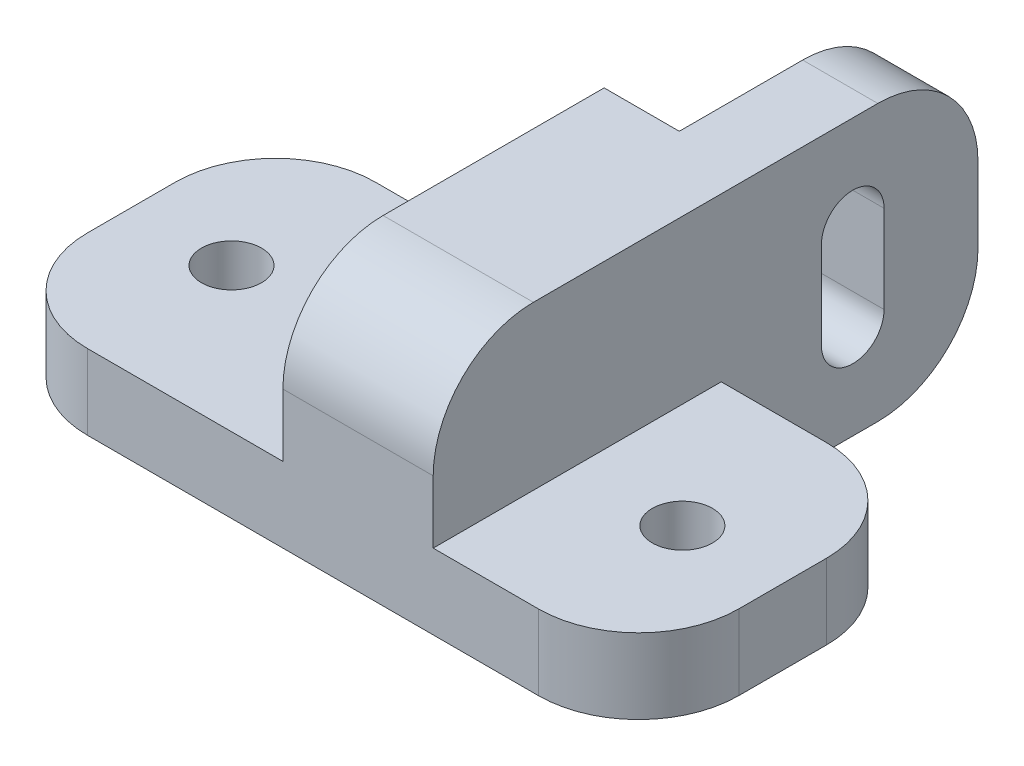
from build123d import *

# Parameters (mm, degrees)
SKETCH1_W           = 26
SKETCH1_H           = 11.5
BOSS_EXTRUDE1_DEPTH = 3
FILLET1_R           = 4
BOSS_EXTRUDE2_DEPTH = 3
FILLET2_R           = 4
BOSS_EXTRUDE3_DEPTH = 3
CUT_EXTRUDE2_DEPTH  = 4
FILLET3_R           = 4
SKETCH5_R           = 1.2
CUT_EXTRUDE3_DEPTH  = 4


with BuildPart() as part:
    # Sketch1 → Boss-Extrude1 (new body)
    with BuildSketch(Plane(origin=(0, 0, 0), x_dir=(1, 0, 0), z_dir=(0, 1, 0))):
        Rectangle(SKETCH1_W, SKETCH1_H)
    extrude(amount=BOSS_EXTRUDE1_DEPTH)

    # Fillet1
    fillet1_edges = [part.edges().sort_by_distance(p)[0] for p in [
        (13, 1.5, 5.75),
        (-13, 1.5, 5.75),
        (-13, 1.5, -5.75),
        (13, 1.5, -5.75),
    ]]
    fillet(fillet1_edges, radius=FILLET1_R)

    # Sketch2 → Boss-Extrude2 (add)
    with BuildSketch(Plane(origin=(1.8, 0, 0), x_dir=(0, 0, -1), z_dir=(1, 0, 0))):
        Polygon((0, 3), (5.75, 3), (5.75, -1.5), (16, -1.5), (16, 3), (16, 9.5), (0, 9.5), (-5.75, 9.5), (-5.75, 3), align=None)
    extrude(amount=BOSS_EXTRUDE2_DEPTH)

    # Fillet2
    fillet2_edges = [part.edges().sort_by_distance(p)[0] for p in [
        (3.3, 9.5, 5.75),
    ]]
    fillet(fillet2_edges, radius=FILLET2_R)

    # Sketch4 → Boss-Extrude3 (add)
    with BuildSketch(Plane.ZY.offset(-1.8)):
        with BuildLine():
            Line((-7.075, 9.5), (-7.075, -1.5))
            Line((-7.075, -1.5), (-5.75, -1.5))
            Line((-5.75, -1.5), (-5.75, 0))
            Line((-5.75, 0), (-5.75, 3))
            Line((-5.75, 3), (5.75, 3))
            Line((5.75, 3), (5.75, 5.5))
            ThreePointArc((5.75, 5.5), (4.578427125, 8.328427125), (1.75, 9.5))
            Line((1.75, 9.5), (-7.075, 9.5))
        make_face()
    extrude(amount=BOSS_EXTRUDE3_DEPTH)

    # Sketch3 → Cut-Extrude2 (cut)
    with BuildSketch(Plane(origin=(4.8, 0, 0), x_dir=(0, 0, -1), z_dir=(1, 0, 0))):
        with BuildLine():
            Line((9.75, 2.25), (9.75, 5.75))
            ThreePointArc((9.75, 5.75), (11, 7), (12.25, 5.75))
            Line((12.25, 5.75), (12.25, 2.25))
            ThreePointArc((12.25, 2.25), (11, 1), (9.75, 2.25))
        make_face()
    extrude(amount=-CUT_EXTRUDE2_DEPTH, mode=Mode.SUBTRACT)

    # Fillet3
    fillet3_edges = [part.edges().sort_by_distance(p)[0] for p in [
        (3.3, -1.5, -16),
        (3.3, 9.5, -16),
    ]]
    fillet(fillet3_edges, radius=FILLET3_R)

    # Sketch5 → Cut-Extrude3 (cut)
    with BuildSketch(Plane.XZ):
        with Locations(Location((8.997973452, -0.000616233, 0), (0, 0, 270))):
            Circle(SKETCH5_R)
        with Locations(Location((-9.000145119, 0.001069025, 0), (0, 0, 270))):
            Circle(SKETCH5_R)
    extrude(amount=-CUT_EXTRUDE3_DEPTH, mode=Mode.SUBTRACT)


solid = part.part
